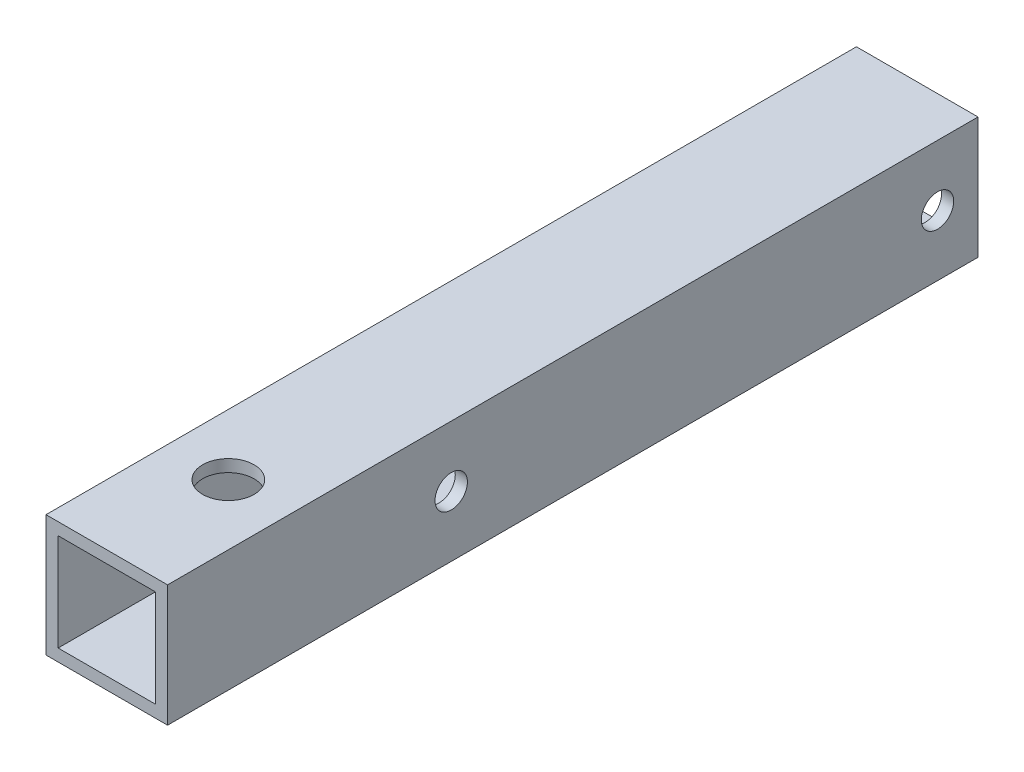
from build123d import *

# Parameters (mm, degrees)
SKETCH_1_W          = 15
SKETCH_1_H          = 15
SKETCH_1_W_2        = 12
SKETCH_1_H_2        = 12
EXTRUDE_1_DEPTH     = 100
SKETCH_2_R          = 2
CUT_EXTRUDE_1_DEPTH = 102.396498953
SKETCH_3_R          = 3.175
CUT_EXTRUDE_2_DEPTH = 102.396498953


with BuildPart() as part:
    # ｽｹｯﾁ1 → 押し出し-薄板1 (new body)
    with BuildSketch(Plane.XY):
        Rectangle(SKETCH_1_W, SKETCH_1_H)
        Rectangle(SKETCH_1_W_2, SKETCH_1_H_2, mode=Mode.SUBTRACT)
    extrude(amount=EXTRUDE_1_DEPTH)

    # ｽｹｯﾁ2 → ｶｯﾄ - 押し出し1 (cut, through all)
    with BuildSketch(Plane(origin=(7.5, 0, 0), x_dir=(0, 0, -1), z_dir=(1, 0, 0))):
        with Locations(Location((-5, 0, 0), (0, 0, 90))):
            Circle(SKETCH_2_R)
        with Locations(Location((-65, 0, 0), (0, 0, 90))):
            Circle(SKETCH_2_R)
    extrude(amount=-CUT_EXTRUDE_1_DEPTH, mode=Mode.SUBTRACT)

    # ｽｹｯﾁ3 → ｶｯﾄ - 押し出し2 (cut, through all)
    with BuildSketch(Plane(origin=(0, 7.5, 0), x_dir=(1, 0, 0), z_dir=(0, 1, 0))):
        with Locations(Location((0, -85, 0), (0, 0, 180))):
            Circle(SKETCH_3_R)
    extrude(amount=-CUT_EXTRUDE_2_DEPTH, mode=Mode.SUBTRACT)


solid = part.part
